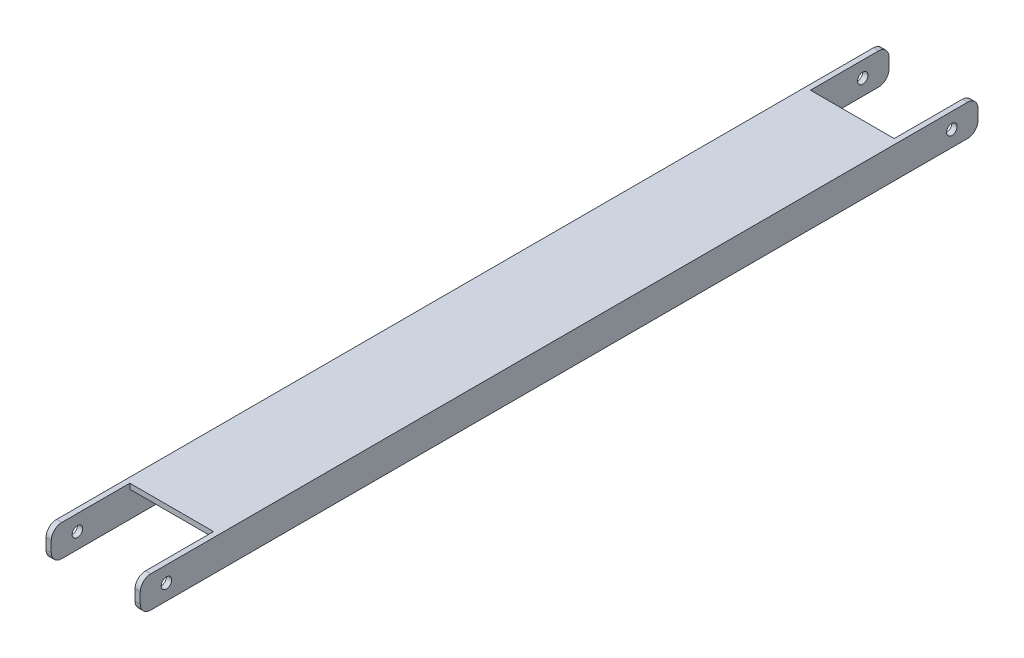
from build123d import *

# Parameters (mm, degrees)
BOSS_EXTRUDE1_DEPTH = 160
SKETCH3_W           = 16
SKETCH3_H           = 15
CUT_EXTRUDE1_DEPTH  = 161.365208197
SKETCH4_W           = 16
SKETCH4_H           = 15
CUT_EXTRUDE2_DEPTH  = 161.365208197
SKETCH5_R           = 1
CUT_EXTRUDE3_DEPTH  = 162.037262769
FILLET1_R           = 2


with BuildPart() as part:
    # Sketch1 → Boss-Extrude1 (new body)
    with BuildSketch(Plane.XY):
        Polygon((8, -3), (8, 2), (-8, 2), (-8, -3), (-9, -3), (-9, 3), (9, 3), (9, -3), align=None)
    extrude(amount=BOSS_EXTRUDE1_DEPTH)

    # Sketch3 → Cut-Extrude1 (cut, through all)
    with BuildSketch(Plane(origin=(0, 3, 0), x_dir=(1, 0, 0), z_dir=(0, 1, 0))):
        with Locations((0, -7.5)):
            Rectangle(SKETCH3_W, SKETCH3_H)
    extrude(amount=-CUT_EXTRUDE1_DEPTH, mode=Mode.SUBTRACT)

    # Sketch4 → Cut-Extrude2 (cut, through all)
    with BuildSketch(Plane(origin=(0, 3, 0), x_dir=(1, 0, 0), z_dir=(0, 1, 0))):
        with Locations((0, -152.5)):
            Rectangle(SKETCH4_W, SKETCH4_H)
    extrude(amount=-CUT_EXTRUDE2_DEPTH, mode=Mode.SUBTRACT)

    # Sketch5 → Cut-Extrude3 (cut, through all)
    with BuildSketch(Plane(origin=(9, 0, 0), x_dir=(0, 0, -1), z_dir=(1, 0, 0))):
        with Locations((-155, 0)):
            Circle(SKETCH5_R)
        with Locations((-5, 0)):
            Circle(SKETCH5_R)
    extrude(amount=-CUT_EXTRUDE3_DEPTH, mode=Mode.SUBTRACT)

    # Fillet1
    fillet1_edges = [part.edges().sort_by_distance(p)[0] for p in [
        (-8.5, -3, 0),
        (8.5, -3, 160),
        (-8.5, 3, 0),
        (8.5, 3, 160),
        (-8.5, 3, 160),
        (-8.5, -3, 160),
        (8.5, 3, 0),
        (8.5, -3, 0),
    ]]
    fillet(fillet1_edges, radius=FILLET1_R)


solid = part.part
